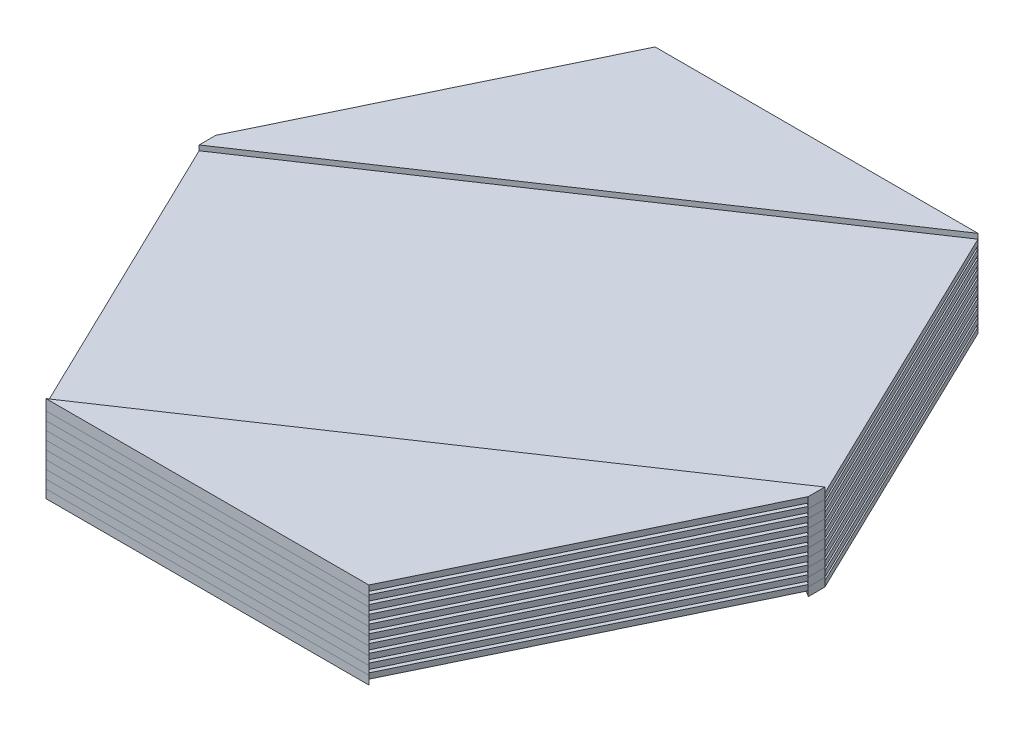
from build123d import *

# Parameters (mm, degrees)
BOSS_EXTRUDE1_DEPTH = 6.35
CUT_EXTRUDE1_DEPTH  = 3.048
CUT_EXTRUDE2_DEPTH  = 3.048
LPATTERN2_COUNT     = 10
LPATTERN2_PITCH     = 5.08


with BuildPart() as part:
    # Sketch1 → Boss-Extrude1 (new body)
    with BuildSketch(Plane(origin=(0, 0, 0), x_dir=(1, 0, 0), z_dir=(0, 1, 0))):
        Polygon((-97, 183), (-183, 5), (-183, -5), (-97, -183), (97, -183), (183, -5), (183, 5), (97, 183), align=None)
    extrude(amount=BOSS_EXTRUDE1_DEPTH)

    # Sketch2 → Cut-Extrude1 (cut)
    with BuildSketch(Plane(origin=(0, 6.35, 0), x_dir=(1, 0, 0), z_dir=(0, 1, 0))):
        Polygon((-183, -5), (97, 183), (183, 5), (-97, -183), align=None)
    extrude(amount=-CUT_EXTRUDE1_DEPTH, mode=Mode.SUBTRACT)

    # Sketch3 → Cut-Extrude2 (cut)
    with BuildSketch(Plane.XZ):
        Polygon((183, 5), (-97, -183), (-183, -5), (97, 183), align=None)
    extrude(amount=-CUT_EXTRUDE2_DEPTH, mode=Mode.SUBTRACT)


with BuildPart() as lpattern2_1:
    # LPattern2: pattern copy
    add(part.part.moved(Location(Vector(0, 1, 0) * (1 * LPATTERN2_PITCH))))


with BuildPart() as lpattern2_2:
    # LPattern2: pattern copy
    add(part.part.moved(Location(Vector(0, 1, 0) * (2 * LPATTERN2_PITCH))))


with BuildPart() as lpattern2_3:
    # LPattern2: pattern copy
    add(part.part.moved(Location(Vector(0, 1, 0) * (3 * LPATTERN2_PITCH))))


with BuildPart() as lpattern2_4:
    # LPattern2: pattern copy
    add(part.part.moved(Location(Vector(0, 1, 0) * (4 * LPATTERN2_PITCH))))


with BuildPart() as lpattern2_5:
    # LPattern2: pattern copy
    add(part.part.moved(Location(Vector(0, 1, 0) * (5 * LPATTERN2_PITCH))))


with BuildPart() as lpattern2_6:
    # LPattern2: pattern copy
    add(part.part.moved(Location(Vector(0, 1, 0) * (6 * LPATTERN2_PITCH))))


with BuildPart() as lpattern2_7:
    # LPattern2: pattern copy
    add(part.part.moved(Location(Vector(0, 1, 0) * (7 * LPATTERN2_PITCH))))


with BuildPart() as lpattern2_8:
    # LPattern2: pattern copy
    add(part.part.moved(Location(Vector(0, 1, 0) * (8 * LPATTERN2_PITCH))))


with BuildPart() as lpattern2_9:
    # LPattern2: pattern copy
    add(part.part.moved(Location(Vector(0, 1, 0) * (9 * LPATTERN2_PITCH))))


solid = Compound([part.part, lpattern2_1.part, lpattern2_2.part, lpattern2_3.part, lpattern2_4.part, lpattern2_5.part, lpattern2_6.part, lpattern2_7.part, lpattern2_8.part, lpattern2_9.part])
